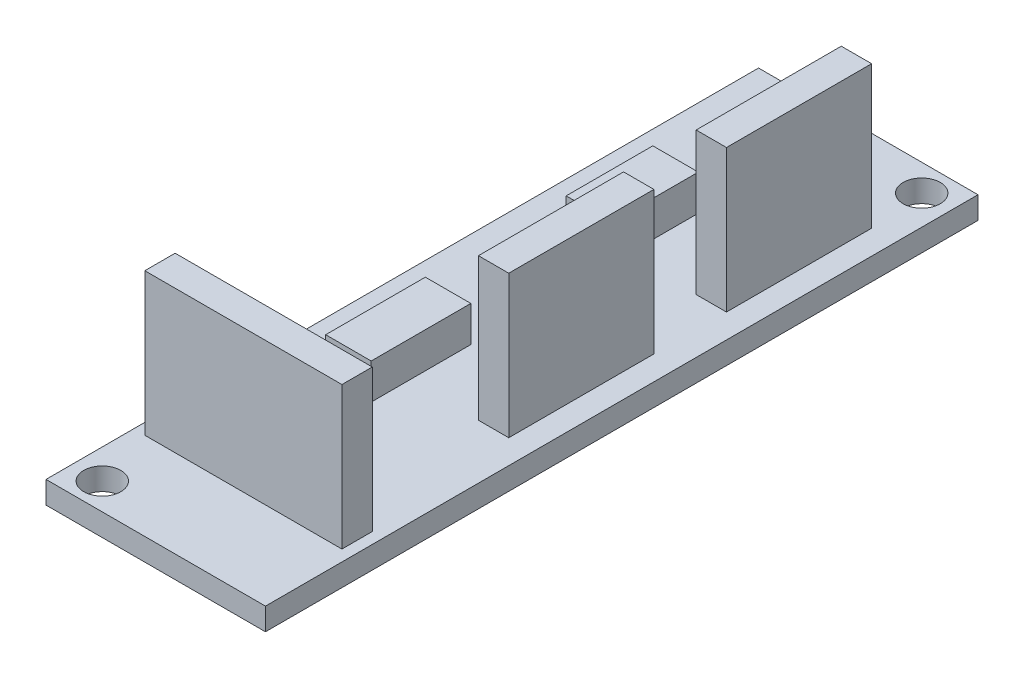
from build123d import *

# Parameters (mm, degrees)
SKETCH1_W           = 19.558
SKETCH1_H           = 63.5
SKETCH1_R           = 1.651
BOSS_EXTRUDE1_DEPTH = 1.984375
SKETCH2_W           = 17.569023062
SKETCH2_H           = 2.702926625
SKETCH2_W_2         = 2.702926625
SKETCH2_H_2         = 12.935434562
BOSS_EXTRUDE3_DEPTH = 12.7
SKETCH2_3_W         = 4.054389937
SKETCH2_3_H         = 7.7226475
SKETCH2_3_H_2       = 8.881044625
BOSS_EXTRUDE4_DEPTH = 3.175


with BuildPart() as part:
    # Sketch1 → Boss-Extrude1 (new body)
    with BuildSketch(Plane(origin=(0, 0, 0), x_dir=(1, 0, 0), z_dir=(0, 1, 0))):
        Rectangle(SKETCH1_W, SKETCH1_H)
        with Locations((7.14375, 29.36875)):
            Circle(SKETCH1_R, mode=Mode.SUBTRACT)
        with Locations((-7.14375, -29.36875)):
            Circle(SKETCH1_R, mode=Mode.SUBTRACT)
    extrude(amount=BOSS_EXTRUDE1_DEPTH)

    # Sketch2 → Boss-Extrude3 (add)
    with BuildSketch(Plane(origin=(0, 1.984375, 0), x_dir=(1, 0, 0), z_dir=(0, 1, 0))):
        with Locations((0, -22.588743937)):
            Rectangle(SKETCH2_W, SKETCH2_H)
        with Locations((6.274651094, 17.955155437)):
            Rectangle(SKETCH2_W_2, SKETCH2_H_2)
        with Locations((6.274651094, -1.447996406)):
            Rectangle(SKETCH2_W_2, SKETCH2_H_2)
    extrude(amount=BOSS_EXTRUDE3_DEPTH)

    # Sketch2<3> → Boss-Extrude4 (add)
    with BuildSketch(Plane(origin=(0, 1.984375, 0), x_dir=(1, 0, 0), z_dir=(0, 1, 0))):
        with Locations((-3.282125188, 13.997298594)):
            Rectangle(SKETCH2_3_W, SKETCH2_3_H)
        with Locations((-3.282125188, -6.853849657)):
            Rectangle(SKETCH2_3_W, SKETCH2_3_H_2)
    extrude(amount=BOSS_EXTRUDE4_DEPTH)


solid = part.part
